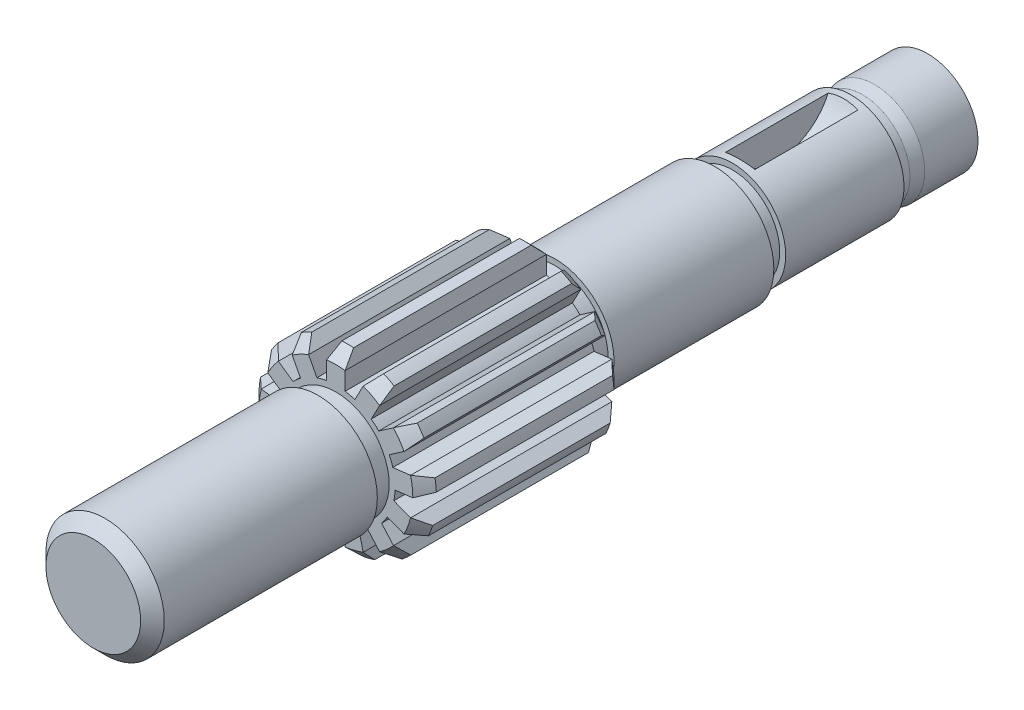
from build123d import *

# Parameters (mm, degrees)
EXTRUDE_START                        = 16
EXTRUDE_1_DEPTH                      = 34
CHAMFER_1_SIZE                       = 2
PATTERN_CIRCULAR_1_COUNT             = 13
CHAMFER_1_OF_PATTERN_CIRCULAR_1_SIZE = 2
CUT_EXTRUDE_1_DEPTH                  = 2.5


with BuildPart() as part:
    # Эскиз1 → Повернуть1 (revolve)
    with BuildSketch(Plane(origin=(0, 0, 0), x_dir=(0, 0, -1), z_dir=(1, 0, 0))):
        Polygon((84.551755586, 0), (84.551755586, 7), (83.551755586, 8.5), (74.551755586, 8.5), (72.551755586, 8), (70.551755586, 8), (70.551755586, 9), (50.551755586, 9), (50.551755586, 8), (47.551755586, 8), (47.551755586, 10), (20.551755586, 10), (20.551755586, 9), (17.551755586, 9), (17.551755586, 10), (-16.448244414, 10), (-16.448244414, 9), (-19.448244414, 9), (-19.448244414, 10), (-55.448244414, 10), (-57.448244414, 8), (-57.448244414, 0), align=None)
    revolve(axis=Axis((0, 0, 57.448244414), (0, 0, -1)))

    # Эскиз2 → Бобышка-Вытянуть1 (add)
    with BuildSketch(Plane.XY.offset(0.448244414).offset(EXTRUDE_START)):
        with BuildLine():
            Line((1.566976519, 9.876466199), (1.566976519, 12.905215403))
            Line((1.566976519, 12.905215403), (0.993843905, 14.967039597))
            ThreePointArc((0.993843905, 14.967039597), (0, 15), (-0.993843905, 14.967039597))
            Line((-0.993843905, 14.967039597), (-1.566976519, 12.905215403))
            Line((-1.566976519, 12.905215403), (-1.566976519, 9.876466199))
            ThreePointArc((-1.566976519, 9.876466199), (0, 10), (1.566976519, 9.876466199))
        make_face()
    extrude_1 = extrude(amount=-EXTRUDE_1_DEPTH)

    # Фаска1
    chamfer_1_edges = [part.edges().sort_by_distance(p)[0] for p in [
        (0, 15, 16.448244414),
        (0, 15, -17.551755586),
    ]]
    chamfer(chamfer_1_edges, length=CHAMFER_1_SIZE)

    # Круговой массив1: Бобышка-Вытянуть1 ×13 about axis
    pattern_circular_1_axis = Axis((0, 0, 57.448244414), (0, 0, 1))
    for i in range(1, PATTERN_CIRCULAR_1_COUNT):
        add(extrude_1.rotate(pattern_circular_1_axis, i * 360 / PATTERN_CIRCULAR_1_COUNT))

    # Фаска1 of Круговой массив1
    chamfer_1_of_pattern_circular_1_edges = [part.edges().sort_by_distance(p)[0] for p in [
        (-6.970847581, 13.281840385, 16.448244414),
        (-6.970847581, 13.281840385, -17.551755586),
        (-12.344757988, 8.520971201, 16.448244414),
        (-12.344757988, 8.520971201, -17.551755586),
        (-14.890633111, 1.808050204, 16.448244414),
        (-14.890633111, 1.808050204, -17.551755586),
        (-14.02524364, -5.319073306, 16.448244414),
        (-14.02524364, -5.319073306, -17.551755586),
        (-9.946839874, -11.227661223, 16.448244414),
        (-9.946839874, -11.227661223, -17.551755586),
        (-3.589734964, -14.564127261, 16.448244414),
        (-3.589734964, -14.564127261, -17.551755586),
        (3.589734964, -14.564127261, 16.448244414),
        (3.589734964, -14.564127261, -17.551755586),
        (9.946839874, -11.227661223, 16.448244414),
        (9.946839874, -11.227661223, -17.551755586),
        (14.02524364, -5.319073306, 16.448244414),
        (14.02524364, -5.319073306, -17.551755586),
        (14.890633111, 1.808050204, 16.448244414),
        (14.890633111, 1.808050204, -17.551755586),
        (12.344757988, 8.520971201, 16.448244414),
        (12.344757988, 8.520971201, -17.551755586),
        (6.970847581, 13.281840385, 16.448244414),
        (6.970847581, 13.281840385, -17.551755586),
    ]]
    chamfer(chamfer_1_of_pattern_circular_1_edges, length=CHAMFER_1_OF_PATTERN_CIRCULAR_1_SIZE)

    # Эскиз3 → Вырез-Вытянуть1 (cut, symmetric)
    with BuildSketch(Plane(origin=(0, 0, 0), x_dir=(0, 0, -1), z_dir=(1, 0, 0))):
        with BuildLine():
            Line((51.264667775, 10.5), (69.838843396, 10.5))
            ThreePointArc((69.838843396, 10.5), (60.551755586, 3), (51.264667775, 10.5))
        make_face()
    extrude(amount=CUT_EXTRUDE_1_DEPTH, both=True, mode=Mode.SUBTRACT)


solid = part.part
